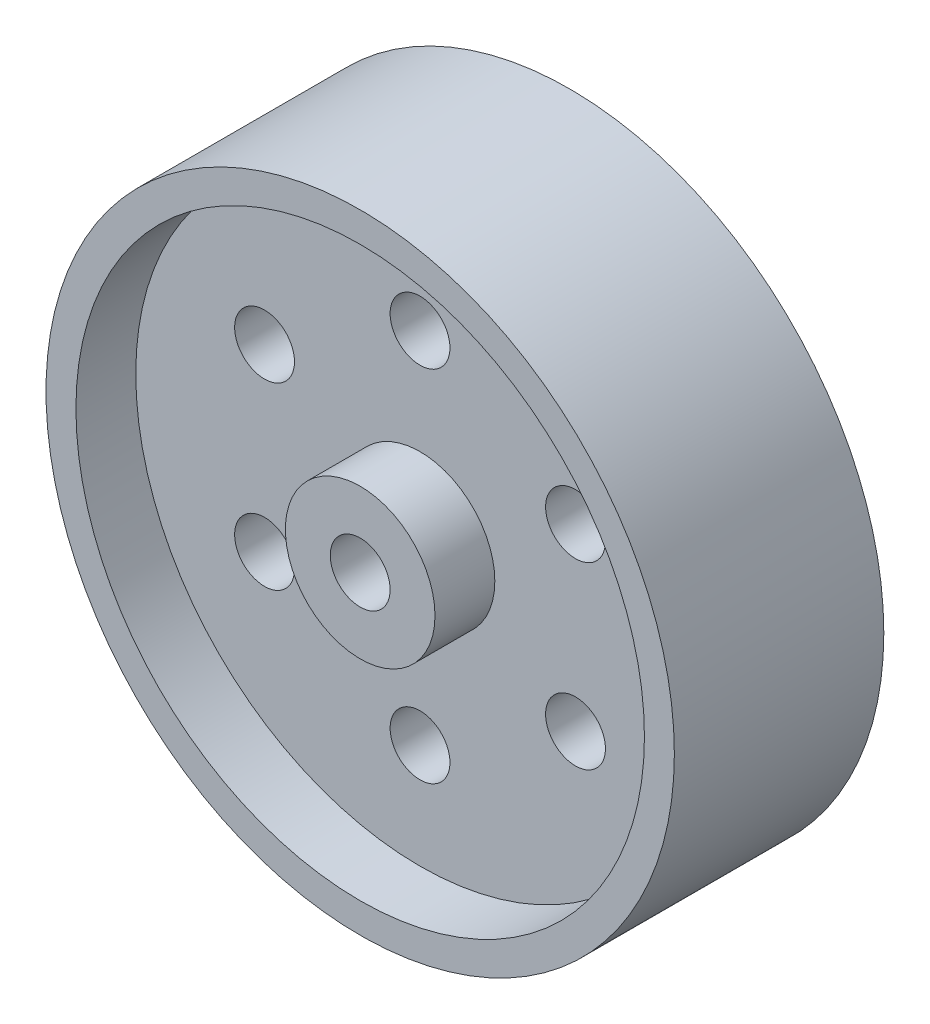
from build123d import *

# Parameters (mm, degrees)
CUT_EXTRUDE1_DEPTH      = 32.336879232
CUT_EXTRUDE1_DEPTH_BACK = 32.336879232
SKETCH2_R               = 2


with BuildPart() as part:
    # Sketch1 → Revolve1 (revolve)
    with BuildSketch(Plane(origin=(0, 0, 0), x_dir=(0, 0, -1), z_dir=(1, 0, 0)), mode=Mode.PRIVATE) as revolve1_sk:
        Polygon((-7, 2), (-7, 5), (-3, 5), (-3, 19), (-7, 19), (-7, 21), (7, 21), (7, 15), (3, 15), (3, 2), align=None)
    revolve(revolve1_sk.sketch.rotate(Axis((0, 0, 26.87166405), (0, 0, -1)), 90), axis=Axis((0, 0, 26.87166405), (0, 0, -1)))

    # Sketch2 → Cut-Extrude1 (cut, two sides: drawn at the far end of the back side and taken through both)
    with BuildSketch(Plane.XY.offset(3).offset(-CUT_EXTRUDE1_DEPTH_BACK)):
        with Locations((0, 12)):
            Circle(SKETCH2_R)
        with Locations((10.392304845, 6)):
            Circle(SKETCH2_R)
        with Locations((10.392304845, -6)):
            Circle(SKETCH2_R)
        with Locations((0, -12)):
            Circle(SKETCH2_R)
        with Locations((-10.392304845, -6)):
            Circle(SKETCH2_R)
        with Locations((-10.392304845, 6)):
            Circle(SKETCH2_R)
    extrude(amount=CUT_EXTRUDE1_DEPTH + CUT_EXTRUDE1_DEPTH_BACK, mode=Mode.SUBTRACT)


solid = part.part
